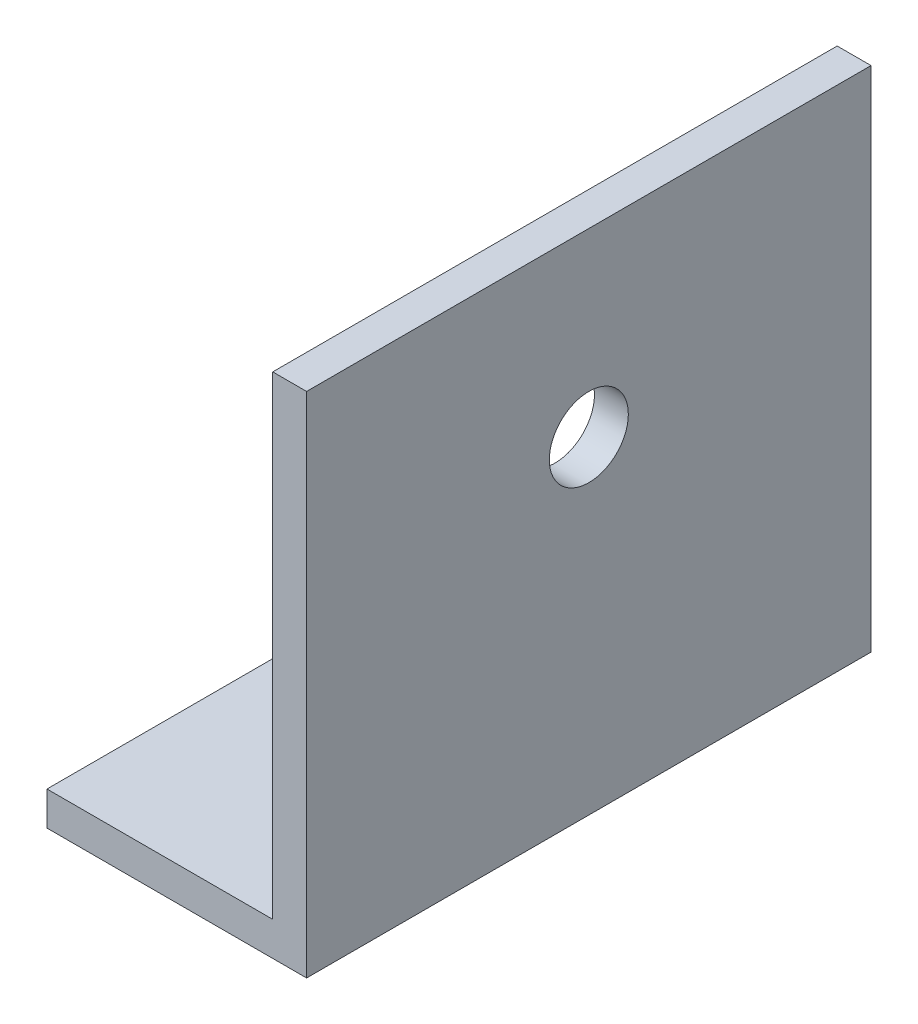
from build123d import *

# Parameters (mm, degrees)
SKETCH1_W           = 20
SKETCH1_H           = 50
BOSS_EXTRUDE1_DEPTH = 3
SKETCH2_W           = 50
SKETCH2_H           = 45
SKETCH2_R           = 3.5
BOSS_EXTRUDE2_DEPTH = 3


with BuildPart() as part:
    # Sketch1 → Boss-Extrude1 (new body)
    with BuildSketch(Plane(origin=(0, 0, 0), x_dir=(1, 0, 0), z_dir=(0, 1, 0))):
        Rectangle(SKETCH1_W, SKETCH1_H)
    extrude(amount=BOSS_EXTRUDE1_DEPTH)

    # Sketch2 → Boss-Extrude2 (add)
    with BuildSketch(Plane(origin=(10, 0, 0), x_dir=(0, 0, -1), z_dir=(1, 0, 0))):
        with Locations((0, 22.5)):
            Rectangle(SKETCH2_W, SKETCH2_H)
        with Locations((0, 29)):
            Circle(SKETCH2_R, mode=Mode.SUBTRACT)
    extrude(amount=BOSS_EXTRUDE2_DEPTH)


solid = part.part
